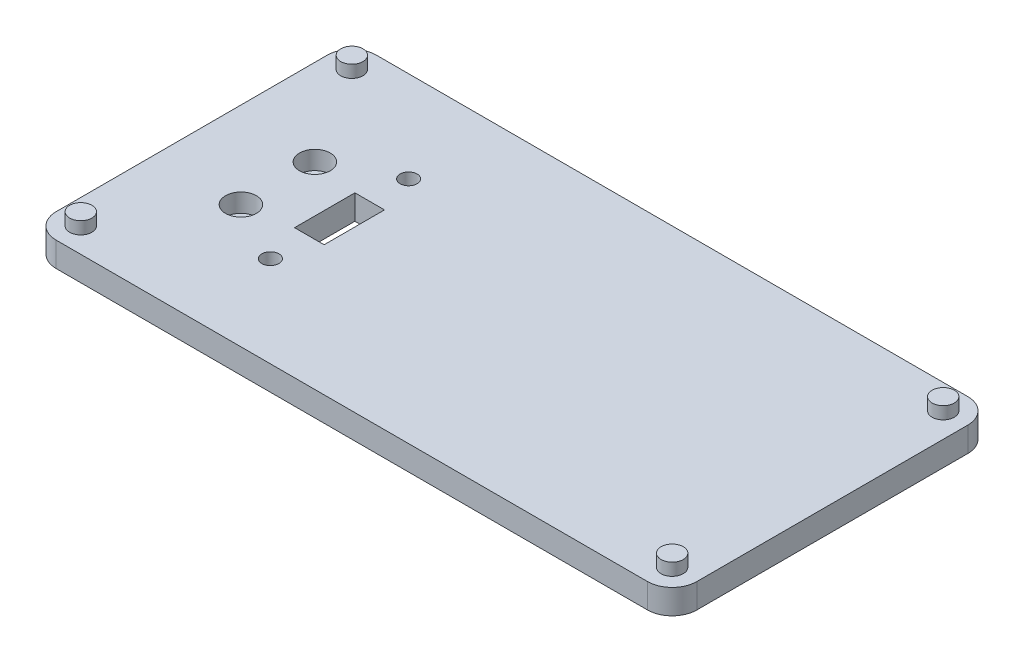
from build123d import *

# Parameters (mm, degrees)
SKETCH1_W           = 121.92
SKETCH1_H           = 66.04
BOSS_EXTRUDE1_DEPTH = 5.08
FILLET1_R           = 5.08
CUT_EXTRUDE2_REACH  = 140.75
SKETCH2_R           = 1.7526
SKETCH2_W           = 6.096
SKETCH2_H           = 12.446
SKETCH3_R           = 3.175
CUT_EXTRUDE3_DEPTH  = 3.81
CUT_EXTRUDE4_REACH  = 140.709
SKETCH4_R           = 1.9812
SKETCH8_W           = 15.24
SKETCH8_H           = 66.04
BOSS_EXTRUDE2_DEPTH = 5.08
FILLET4_R           = 5.08
SKETCH5_R           = 2.286
BOSS_EXTRUDE3_DEPTH = 2.54


with BuildPart() as part:
    # Sketch1 → Boss-Extrude1 (new body)
    with BuildSketch(Plane(origin=(0, 0, 0), x_dir=(1, 0, 0), z_dir=(0, 1, 0))):
        with Locations((60.96, 33.02)):
            Rectangle(SKETCH1_W, SKETCH1_H)
    extrude(amount=BOSS_EXTRUDE1_DEPTH)

    # Fillet1
    fillet1_edges = [part.edges().sort_by_distance(p)[0] for p in [
        (0, 2.54, -66.04),
        (121.92, 2.54, -66.04),
        (121.92, 2.54, 0),
        (0, 2.54, 0),
    ]]
    fillet(fillet1_edges, radius=FILLET1_R)

    # Sketch2 → Cut-Extrude2 (cut, up to next)
    with BuildSketch(Plane(origin=(0, 5.08, 0), x_dir=(1, 0, 0), z_dir=(0, 1, 0)), mode=Mode.PRIVATE) as cut_extrude2_sk1:
        with Locations(Location((30.48, 47.2694, 0), (0, 0, 270))):
            Circle(SKETCH2_R)
    cut_extrude2_tool1 = extrude(cut_extrude2_sk1.sketch, amount=-CUT_EXTRUDE2_REACH, mode=Mode.PRIVATE) & part.part
    # Sketch2 → Cut-Extrude2 (cut, up to next)
    with BuildSketch(Plane(origin=(0, 5.08, 0), x_dir=(1, 0, 0), z_dir=(0, 1, 0)), mode=Mode.PRIVATE) as cut_extrude2_sk2:
        with Locations(Location((30.48, 18.7706, 0), (0, 0, 90))):
            Circle(SKETCH2_R)
    cut_extrude2_tool2 = extrude(cut_extrude2_sk2.sketch, amount=-CUT_EXTRUDE2_REACH, mode=Mode.PRIVATE) & part.part
    # Sketch2 → Cut-Extrude2 (cut, up to next)
    with BuildSketch(Plane(origin=(0, 5.08, 0), x_dir=(1, 0, 0), z_dir=(0, 1, 0)), mode=Mode.PRIVATE) as cut_extrude2_sk3:
        with Locations((30.48, 33.02)):
            Rectangle(SKETCH2_W, SKETCH2_H)
    cut_extrude2_tool3 = extrude(cut_extrude2_sk3.sketch, amount=-CUT_EXTRUDE2_REACH, mode=Mode.PRIVATE) & part.part
    add(cut_extrude2_tool1.solids().sort_by_distance((30.48, 5.08, -47.2694))[0], mode=Mode.SUBTRACT)
    add(cut_extrude2_tool2.solids().sort_by_distance((30.48, 5.08, -18.7706))[0], mode=Mode.SUBTRACT)
    add(cut_extrude2_tool3.solids().sort_by_distance((30.48, 5.08, -33.02))[0], mode=Mode.SUBTRACT)

    # Sketch3 → Cut-Extrude3 (cut)
    with BuildSketch(Plane(origin=(0, 5.08, 0), x_dir=(1, 0, 0), z_dir=(0, 1, 0))):
        with Locations(Location((17.78, 40.64, 0), (0, 0, 270))):
            Circle(SKETCH3_R)
        with Locations(Location((17.78, 25.4, 0), (0, 0, 270))):
            Circle(SKETCH3_R)
    extrude(amount=-CUT_EXTRUDE3_DEPTH, mode=Mode.SUBTRACT)

    # Sketch4 → Cut-Extrude4 (cut, up to next)
    with BuildSketch(Plane(origin=(0, 1.27, 0), x_dir=(1, 0, 0), z_dir=(0, 1, 0)), mode=Mode.PRIVATE) as cut_extrude4_sk1:
        with Locations(Location((17.78, 40.64, 0), (0, 0, 270))):
            Circle(SKETCH4_R)
    cut_extrude4_tool1 = extrude(cut_extrude4_sk1.sketch, amount=-CUT_EXTRUDE4_REACH, mode=Mode.PRIVATE) & part.part
    # Sketch4 → Cut-Extrude4 (cut, up to next)
    with BuildSketch(Plane(origin=(0, 1.27, 0), x_dir=(1, 0, 0), z_dir=(0, 1, 0)), mode=Mode.PRIVATE) as cut_extrude4_sk2:
        with Locations(Location((17.78, 25.4, 0), (0, 0, 270))):
            Circle(SKETCH4_R)
    cut_extrude4_tool2 = extrude(cut_extrude4_sk2.sketch, amount=-CUT_EXTRUDE4_REACH, mode=Mode.PRIVATE) & part.part
    add(cut_extrude4_tool1.solids().sort_by_distance((17.78, 1.27, -40.64))[0], mode=Mode.SUBTRACT)
    add(cut_extrude4_tool2.solids().sort_by_distance((17.78, 1.27, -25.4))[0], mode=Mode.SUBTRACT)

    # Sketch8 → Boss-Extrude2 (add)
    with BuildSketch(Plane.XZ):
        with Locations((124.46, -33.02)):
            Rectangle(SKETCH8_W, SKETCH8_H)
    extrude(amount=-BOSS_EXTRUDE2_DEPTH)

    # Fillet4
    fillet4_edges = [part.edges().sort_by_distance(p)[0] for p in [
        (132.08, 2.54, 0),
        (132.08, 2.54, -66.04),
    ]]
    fillet(fillet4_edges, radius=FILLET4_R)

    # Sketch5 → Boss-Extrude3 (add)
    with BuildSketch(Plane(origin=(0, 5.08, 0), x_dir=(1, 0, 0), z_dir=(0, 1, 0))):
        with Locations(Location((5.08, 60.96, 0), (0, 0, 90))):
            Circle(SKETCH5_R)
        with Locations(Location((127, 60.96, 0), (0, 0, 90))):
            Circle(SKETCH5_R)
        with Locations(Location((127, 5.08, 0), (0, 0, 90))):
            Circle(SKETCH5_R)
        with Locations(Location((5.08, 5.08, 0), (0, 0, 90))):
            Circle(SKETCH5_R)
    extrude(amount=BOSS_EXTRUDE3_DEPTH)


solid = part.part
